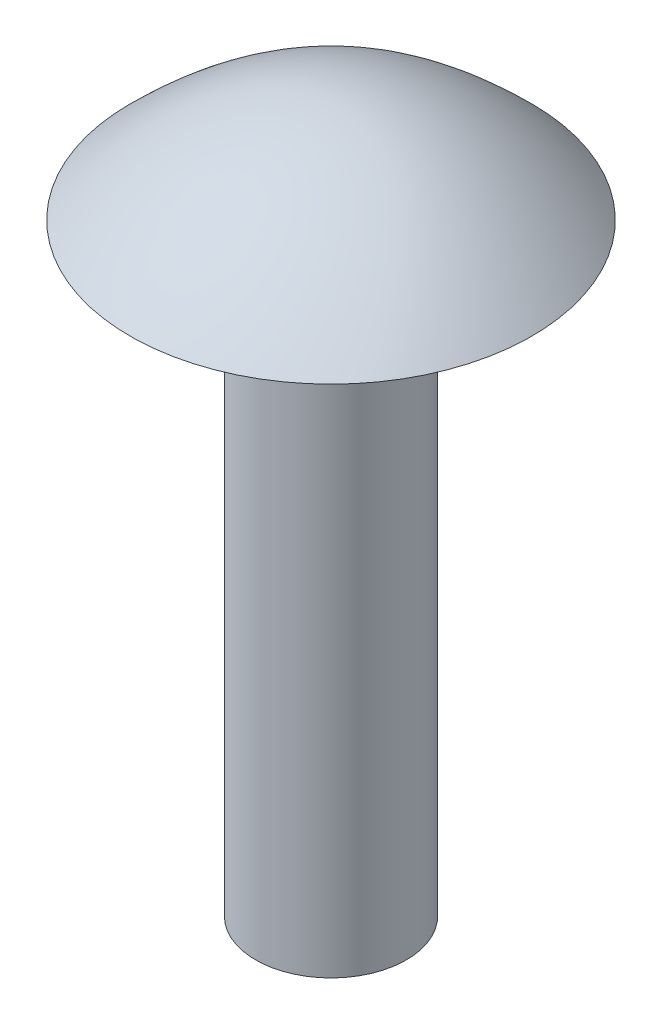
from build123d import *


with BuildPart() as part:
    # Sketch1 → Revolve1 (revolve)
    with BuildSketch(Plane.XY, mode=Mode.PRIVATE) as revolve1_sk:
        with BuildLine():
            Line((0, 0), (0, 6))
            Line((0, 6), (-1.25, 6))
            add(Edge.make_bspline(
                [(-1.25, 6), (-0.25, 7), (0.75, 7)],
                knots=[0, 0, 0, 0.5, 0.5, 0.5], degree=2))
            Line((0.75, 7), (0.75, 0))
            Line((0.75, 0), (0, 0))
        make_face()
    revolve(revolve1_sk.sketch.rotate(Axis((0.75, -1.404443636, 0), (0, 1, 0)), 270), axis=Axis((0.75, -1.404443636, 0), (0, 1, 0)))


solid = part.part
